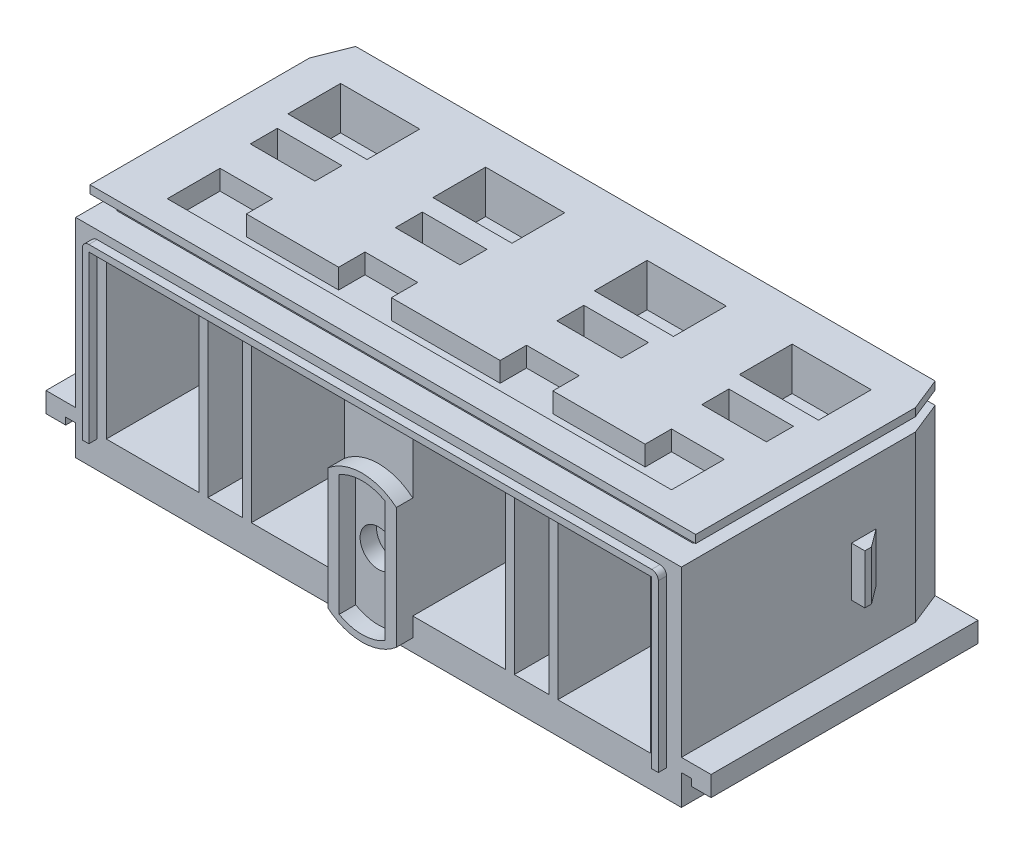
from build123d import *

# Parameters (mm, degrees)
CUBO_BASE_DEPTH                     = 31.59
GUIAS_LATERALES_DEPTH               = 40.5
TRABAS_LATERALES_DEPTH              = 7.5
CROQUIS4_W                          = 87.4
CROQUIS4_H                          = 33.5
BURLETE_DEPTH                       = 2
TAPA_SUPERIOR_DEPTH                 = 1.2
BORNERAS_DEPTH                      = 1.44
SALIENTE_FRONTAL_DEPTH              = 1.25
CROQUIS9_W                          = 14.1
CROQUIS9_H                          = 24.5
CROQUIS9_W_2                        = 5.3
CORTE_EN_PROFUNDIDAD_FRONTAL_DEPTH  = 37.3
CORTE_EN_PROFUNDIDAD_INFERIOR_DEPTH = 5
TORNILLO_DEPTH                      = 2.5
CROQUIS15_R                         = 2.8
TORNILLO2_DEPTH                     = 2.5
INTERIORBORNE_REACH                 = 102.727
CROQUIS17_W                         = 9.8
CROQUIS17_H                         = 4.1
BORNESUPERIOR_DEPTH                 = 10
CROQUIS18_W                         = 12
CROQUIS18_H                         = 8
CORTAR_EXTRUIR8_DEPTH               = 6.5
CORTAR_EXTRUIR9_DEPTH               = 3


with BuildPart() as part:
    # Croquis1 → Cubo base (new body)
    with BuildSketch(Plane(origin=(0, 0, 0), x_dir=(1, 0, 0), z_dir=(0, 1, 0))):
        Polygon((-45.95, -20.25), (-45.95, 15.25), (-43.95, 20.25), (43.95, 20.25), (45.95, 15.25), (45.95, -20.25), align=None)
    extrude(amount=CUBO_BASE_DEPTH)

    # Croquis2 → Guias laterales (add)
    with BuildSketch(Plane.XY.offset(20.25)):
        Polygon((45.95, 6.59), (50.45, 6.59), (50.45, 3.54), (47.46, 3.54), (47.46, 4.59), (45.95, 4.59), (43.95, 4.59), (43.95, 6.59), align=None)
        Polygon((-50.45, 6.59), (-50.45, 3.54), (-47.46, 3.54), (-47.46, 4.59), (-45.95, 4.59), (-43.95, 4.59), (-43.95, 6.59), (-45.95, 6.59), align=None)
    extrude(amount=-GUIAS_LATERALES_DEPTH)

    # Croquis3 → Trabas_Laterales (add)
    with BuildSketch(Plane(origin=(0, 21.84, 0), x_dir=(1, 0, 0), z_dir=(0, 1, 0))):
        Polygon((-45.95, 9.28014545), (-45.95, 5.55), (-47.98, 5.55), (-47.98, 6.55), align=None)
        Polygon((45.95, 5.55), (47.98, 5.55), (47.98, 6.55), (45.95, 9.28014545), align=None)
    extrude(amount=-TRABAS_LATERALES_DEPTH)

    # Croquis4 → Burlete (add)
    with BuildSketch(Plane(origin=(0, 31.59, 0), x_dir=(1, 0, 0), z_dir=(0, 1, 0))):
        with Locations((0, 0.5)):
            Rectangle(CROQUIS4_W, CROQUIS4_H)
    extrude(amount=BURLETE_DEPTH)

    # Croquis5 → Tapa Superior (add)
    with BuildSketch(Plane(origin=(0, 33.59, 0), x_dir=(1, 0, 0), z_dir=(0, 1, 0))):
        Polygon((-45.95, 15.25), (-43.95, 20.25), (43.95, 20.25), (45.95, 15.25), (45.95, -18.08), (-45.95, -18.08), align=None)
    extrude(amount=TAPA_SUPERIOR_DEPTH)

    # Croquis7 → Borneras (cut)
    # profile 1 of 5: a face of its own
    with BuildSketch(Plane.XZ):
        with BuildLine():
            Line((43, 17.25), (-43, 17.25))
            ThreePointArc((-43, 17.25), (-43.707106781, 16.957106781), (-44, 16.25))
            Line((-44, 16.25), (-44, -16.25))
            ThreePointArc((-44, -16.25), (-43.707106781, -16.957106781), (-43, -17.25))
            Line((-43, -17.25), (43, -17.25))
            ThreePointArc((43, -17.25), (43.707106781, -16.957106781), (44, -16.25))
            Line((44, -16.25), (44, 16.25))
            ThreePointArc((44, 16.25), (43.707106781, 16.957106781), (43, 17.25))
        make_face()
        with BuildLine():
            ThreePointArc((-41.5, -2), (-41.207106781, -1.292893219), (-40.5, -1))
            Line((-40.5, -1), (-28, -1))
            ThreePointArc((-28, -1), (-27.292893219, -1.292893219), (-27, -2))
            Line((-27, -2), (-27, -14))
            ThreePointArc((-27, -14), (-27.292893219, -14.707106781), (-28, -15))
            Line((-28, -15), (-40.5, -15))
            ThreePointArc((-40.5, -15), (-41.207106781, -14.707106781), (-41.5, -14))
            Line((-41.5, -14), (-41.5, -2))
        make_face(mode=Mode.SUBTRACT)
        with BuildLine():
            ThreePointArc((-5, -14), (-5.292893219, -14.707106781), (-6, -15))
            Line((-6, -15), (-18.5, -15))
            ThreePointArc((-18.5, -15), (-19.207106781, -14.707106781), (-19.5, -14))
            Line((-19.5, -14), (-19.5, -2))
            ThreePointArc((-19.5, -2), (-19.207106781, -1.292893219), (-18.5, -1))
            Line((-18.5, -1), (-6, -1))
            ThreePointArc((-6, -1), (-5.292893219, -1.292893219), (-5, -2))
            Line((-5, -2), (-5, -14))
        make_face(mode=Mode.SUBTRACT)
        with BuildLine():
            Line((5, -14), (5, -2))
            ThreePointArc((5, -2), (5.292893219, -1.292893219), (6, -1))
            Line((6, -1), (18.5, -1))
            ThreePointArc((18.5, -1), (19.207106781, -1.292893219), (19.5, -2))
            Line((19.5, -2), (19.5, -14))
            ThreePointArc((19.5, -14), (19.207106781, -14.707106781), (18.5, -15))
            Line((18.5, -15), (6, -15))
            ThreePointArc((6, -15), (5.292893219, -14.707106781), (5, -14))
        make_face(mode=Mode.SUBTRACT)
        with BuildLine():
            Line((27, -14), (27, -2))
            ThreePointArc((27, -2), (27.292893219, -1.292893219), (28, -1))
            Line((28, -1), (40.5, -1))
            ThreePointArc((40.5, -1), (41.207106781, -1.292893219), (41.5, -2))
            Line((41.5, -2), (41.5, -14))
            ThreePointArc((41.5, -14), (41.207106781, -14.707106781), (40.5, -15))
            Line((40.5, -15), (28, -15))
            ThreePointArc((28, -15), (27.292893219, -14.707106781), (27, -14))
        make_face(mode=Mode.SUBTRACT)
    # profile 2 of 5: a face of its own
    with BuildSketch(Plane.XZ):
        with BuildLine():
            Line((-30.330357143, -3.25), (-38.169642857, -3.25))
            ThreePointArc((-38.169642857, -3.25), (-38.876749638, -3.542893219), (-39.169642857, -4.25))
            Line((-39.169642857, -4.25), (-39.169642857, -11.75))
            ThreePointArc((-39.169642857, -11.75), (-38.876749638, -12.457106781), (-38.169642857, -12.75))
            Line((-38.169642857, -12.75), (-30.330357143, -12.75))
            ThreePointArc((-30.330357143, -12.75), (-29.623250362, -12.457106781), (-29.330357143, -11.75))
            Line((-29.330357143, -11.75), (-29.330357143, -4.25))
            ThreePointArc((-29.330357143, -4.25), (-29.623250362, -3.542893219), (-30.330357143, -3.25))
        make_face()
    # profile 3 of 5: a face of its own
    with BuildSketch(Plane.XZ):
        with BuildLine():
            ThreePointArc((-16.169642857, -3.25), (-16.876749638, -3.542893219), (-17.169642857, -4.25))
            Line((-17.169642857, -4.25), (-17.169642857, -11.75))
            ThreePointArc((-17.169642857, -11.75), (-16.876749638, -12.457106781), (-16.169642857, -12.75))
            Line((-16.169642857, -12.75), (-8.330357143, -12.75))
            ThreePointArc((-8.330357143, -12.75), (-7.623250362, -12.457106781), (-7.330357143, -11.75))
            Line((-7.330357143, -11.75), (-7.330357143, -4.25))
            ThreePointArc((-7.330357143, -4.25), (-7.623250362, -3.542893219), (-8.330357143, -3.25))
            Line((-8.330357143, -3.25), (-16.169642857, -3.25))
        make_face()
    # profile 4 of 5: a face of its own
    with BuildSketch(Plane.XZ):
        with BuildLine():
            ThreePointArc((7.330357143, -11.75), (7.623250362, -12.457106781), (8.330357143, -12.75))
            Line((8.330357143, -12.75), (16.169642857, -12.75))
            ThreePointArc((16.169642857, -12.75), (16.876749638, -12.457106781), (17.169642857, -11.75))
            Line((17.169642857, -11.75), (17.169642857, -4.25))
            ThreePointArc((17.169642857, -4.25), (16.876749638, -3.542893219), (16.169642857, -3.25))
            Line((16.169642857, -3.25), (8.330357143, -3.25))
            ThreePointArc((8.330357143, -3.25), (7.623250362, -3.542893219), (7.330357143, -4.25))
            Line((7.330357143, -4.25), (7.330357143, -11.75))
        make_face()
    # profile 5 of 5: a face of its own
    with BuildSketch(Plane.XZ):
        with BuildLine():
            ThreePointArc((30.330357143, -3.25), (29.623250362, -3.542893219), (29.330357143, -4.25))
            Line((29.330357143, -4.25), (29.330357143, -11.75))
            ThreePointArc((29.330357143, -11.75), (29.623250362, -12.457106781), (30.330357143, -12.75))
            Line((30.330357143, -12.75), (38.169642857, -12.75))
            ThreePointArc((38.169642857, -12.75), (38.876749638, -12.457106781), (39.169642857, -11.75))
            Line((39.169642857, -11.75), (39.169642857, -4.25))
            ThreePointArc((39.169642857, -4.25), (38.876749638, -3.542893219), (38.169642857, -3.25))
            Line((38.169642857, -3.25), (30.330357143, -3.25))
        make_face()
    extrude(amount=-BORNERAS_DEPTH, mode=Mode.SUBTRACT)

    # Croquis8 → Saliente_Frontal (add)
    with BuildSketch(Plane.XY.offset(20.25)):
        with BuildLine():
            Line((-42.7, 30.29), (42.7, 30.29))
            ThreePointArc((42.7, 30.29), (43.407106781, 29.997106781), (43.7, 29.29))
            Line((43.7, 29.29), (43.7, 4.09))
            Line((43.7, 4.09), (42.7, 4.09))
            Line((42.7, 4.09), (42.7, 29.29))
            Line((42.7, 29.29), (-42.7, 29.29))
            Line((-42.7, 29.29), (-42.7, 4.09))
            Line((-42.7, 4.09), (-43.7, 4.09))
            Line((-43.7, 4.09), (-43.7, 29.29))
            ThreePointArc((-43.7, 29.29), (-43.407106781, 29.997106781), (-42.7, 30.29))
        make_face()
    extrude(amount=SALIENTE_FRONTAL_DEPTH)

    # Croquis9 → Corte en profundidad frontal (cut)
    with BuildSketch(Plane.XY.offset(20.25)):
        with Locations((-34.25, 17.04)):
            Rectangle(CROQUIS9_W, CROQUIS9_H)
        with Locations((-12.25, 17.04)):
            Rectangle(CROQUIS9_W, CROQUIS9_H)
        with Locations((12.25, 17.04)):
            Rectangle(CROQUIS9_W, CROQUIS9_H)
        with Locations((34.25, 17.04)):
            Rectangle(CROQUIS9_W, CROQUIS9_H)
        with Locations((-23.25, 17.04)):
            Rectangle(CROQUIS9_W_2, CROQUIS9_H)
        with Locations((23.25, 17.04)):
            Rectangle(CROQUIS9_W_2, CROQUIS9_H)
    extrude(amount=-CORTE_EN_PROFUNDIDAD_FRONTAL_DEPTH, mode=Mode.SUBTRACT)

    # Croquis13 → Corte en profundidad inferior (cut)
    with BuildSketch(Plane.XZ.offset(-1.44)):
        with BuildLine():
            Line((-30.330357143, -3.25), (-38.169642857, -3.25))
            ThreePointArc((-38.169642857, -3.25), (-38.876749638, -3.542893219), (-39.169642857, -4.25))
            Line((-39.169642857, -4.25), (-39.169642857, -11.75))
            ThreePointArc((-39.169642857, -11.75), (-38.876749638, -12.457106781), (-38.169642857, -12.75))
            Line((-38.169642857, -12.75), (-30.330357143, -12.75))
            ThreePointArc((-30.330357143, -12.75), (-29.623250362, -12.457106781), (-29.330357143, -11.75))
            Line((-29.330357143, -11.75), (-29.330357143, -4.25))
            ThreePointArc((-29.330357143, -4.25), (-29.623250362, -3.542893219), (-30.330357143, -3.25))
        make_face()
        with BuildLine():
            Line((-7.330357143, -11.75), (-7.330357143, -4.25))
            ThreePointArc((-7.330357143, -4.25), (-7.623250362, -3.542893219), (-8.330357143, -3.25))
            Line((-8.330357143, -3.25), (-16.169642857, -3.25))
            ThreePointArc((-16.169642857, -3.25), (-16.876749638, -3.542893219), (-17.169642857, -4.25))
            Line((-17.169642857, -4.25), (-17.169642857, -11.75))
            ThreePointArc((-17.169642857, -11.75), (-16.876749638, -12.457106781), (-16.169642857, -12.75))
            Line((-16.169642857, -12.75), (-8.330357143, -12.75))
            ThreePointArc((-8.330357143, -12.75), (-7.623250362, -12.457106781), (-7.330357143, -11.75))
        make_face()
        with BuildLine():
            Line((8.330357143, -12.75), (16.169642857, -12.75))
            ThreePointArc((16.169642857, -12.75), (16.876749638, -12.457106781), (17.169642857, -11.75))
            Line((17.169642857, -11.75), (17.169642857, -4.25))
            ThreePointArc((17.169642857, -4.25), (16.876749638, -3.542893219), (16.169642857, -3.25))
            Line((16.169642857, -3.25), (8.330357143, -3.25))
            ThreePointArc((8.330357143, -3.25), (7.623250362, -3.542893219), (7.330357143, -4.25))
            Line((7.330357143, -4.25), (7.330357143, -11.75))
            ThreePointArc((7.330357143, -11.75), (7.623250362, -12.457106781), (8.330357143, -12.75))
        make_face()
        with BuildLine():
            Line((38.169642857, -3.25), (30.330357143, -3.25))
            ThreePointArc((30.330357143, -3.25), (29.623250362, -3.542893219), (29.330357143, -4.25))
            Line((29.330357143, -4.25), (29.330357143, -11.75))
            ThreePointArc((29.330357143, -11.75), (29.623250362, -12.457106781), (30.330357143, -12.75))
            Line((30.330357143, -12.75), (38.169642857, -12.75))
            ThreePointArc((38.169642857, -12.75), (38.876749638, -12.457106781), (39.169642857, -11.75))
            Line((39.169642857, -11.75), (39.169642857, -4.25))
            ThreePointArc((39.169642857, -4.25), (38.876749638, -3.542893219), (38.169642857, -3.25))
        make_face()
    extrude(amount=-CORTE_EN_PROFUNDIDAD_INFERIOR_DEPTH, mode=Mode.SUBTRACT)

    # Croquis14 → Tornillo (add)
    with BuildSketch(Plane.XY.offset(20.25)):
        with BuildLine():
            Line((-5.2, 20.29), (-5.2, 1.920526339))
            ThreePointArc((-5.2, 1.920526339), (0, 0), (5.2, 1.920526339))
            Line((5.2, 1.920526339), (5.2, 20.29))
            ThreePointArc((5.2, 20.29), (0, 22.210526339), (-5.2, 20.29))
        make_face()
        with BuildLine():
            Line((-3.469870315, 20.29), (-3.469870315, 1.920526339))
            ThreePointArc((-3.469870315, 1.920526339), (0, 1), (3.469870315, 1.920526339))
            Line((3.469870315, 1.920526339), (3.469870315, 20.29))
            ThreePointArc((3.469870315, 20.29), (0, 21.210526339), (-3.469870315, 20.29))
        make_face(mode=Mode.SUBTRACT)
    extrude(amount=TORNILLO_DEPTH)

    # Croquis15 → Tornillo2 (cut)
    with BuildSketch(Plane.XY.offset(20.25)):
        with Locations((0, 11.105263169)):
            Circle(CROQUIS15_R)
    extrude(amount=-TORNILLO2_DEPTH, mode=Mode.SUBTRACT)

    # InteriorBorne: up to this face of the body (flat: up to its plane)
    interiorborne_end = Plane(part.part.faces().sort_by_distance((41.3, 17.04, 1.6))[0])
    # Croquis16 → InteriorBorne (add, up to the picked face)
    with BuildSketch(Plane(origin=(-41.3, 0, 0), x_dir=(0, 0, -1), z_dir=(1, 0, 0)), mode=Mode.PRIVATE) as interiorborne_sk1:
        Polygon((-10.66, 29.29), (-5.95, 26.47), (17.05, 26.47), (17.05, 29.29), align=None)
    interiorborne_tool1 = split(extrude(interiorborne_sk1.sketch, amount=INTERIORBORNE_REACH, mode=Mode.PRIVATE), bisect_by=interiorborne_end, keep=Keep.BOTH, mode=Mode.PRIVATE)
    add(interiorborne_tool1.solids().sort_by(Axis((-41.3, 27.923654, -4.336044), (1, 0, 0)))[0])

    # Croquis17 → BorneSuperior (cut)
    with BuildSketch(Plane(origin=(0, 34.79, 0), x_dir=(1, 0, 0), z_dir=(0, 1, 0))):
        with Locations((-34.25, 1.5)):
            Rectangle(CROQUIS17_W, CROQUIS17_H)
        with Locations((-12.25, 1.5)):
            Rectangle(CROQUIS17_W, CROQUIS17_H)
        with Locations((12.25, 1.5)):
            Rectangle(CROQUIS17_W, CROQUIS17_H)
        with Locations((34.25, 1.5)):
            Rectangle(CROQUIS17_W, CROQUIS17_H)
    extrude(amount=-BORNESUPERIOR_DEPTH, mode=Mode.SUBTRACT)

    # Croquis18 → Cortar-Extruir8 (cut)
    with BuildSketch(Plane(origin=(0, 34.79, 0), x_dir=(1, 0, 0), z_dir=(0, 1, 0))):
        with Locations((-34.25, 10.25)):
            Rectangle(CROQUIS18_W, CROQUIS18_H)
        with Locations((-12.25, 10.25)):
            Rectangle(CROQUIS18_W, CROQUIS18_H)
        with Locations((34.25, 10.25)):
            Rectangle(CROQUIS18_W, CROQUIS18_H)
        with Locations((12.25, 10.25)):
            Rectangle(CROQUIS18_W, CROQUIS18_H)
    extrude(amount=-CORTAR_EXTRUIR8_DEPTH, mode=Mode.SUBTRACT)

    # Croquis19 → Cortar-Extruir9 (cut)
    with BuildSketch(Plane(origin=(0, 34.79, 0), x_dir=(1, 0, 0), z_dir=(0, 1, 0))):
        Polygon((-8.25, -14.05), (8.25, -14.05), (23.25, -14.05), (38.25, -14.05), (38.25, -6.05), (30.25, -6.05), (30.25, -10.05), (16.25, -10.05), (16.25, -6.05), (8.25, -6.05), (8.25, -10.05), (-8.25, -10.05), (-8.25, -6.05), (-16.25, -6.05), (-16.25, -10.05), (-30.25, -10.05), (-30.25, -6.05), (-38.25, -6.05), (-38.25, -14.05), (-23.25, -14.05), align=None)
    extrude(amount=-CORTAR_EXTRUIR9_DEPTH, mode=Mode.SUBTRACT)


solid = part.part
